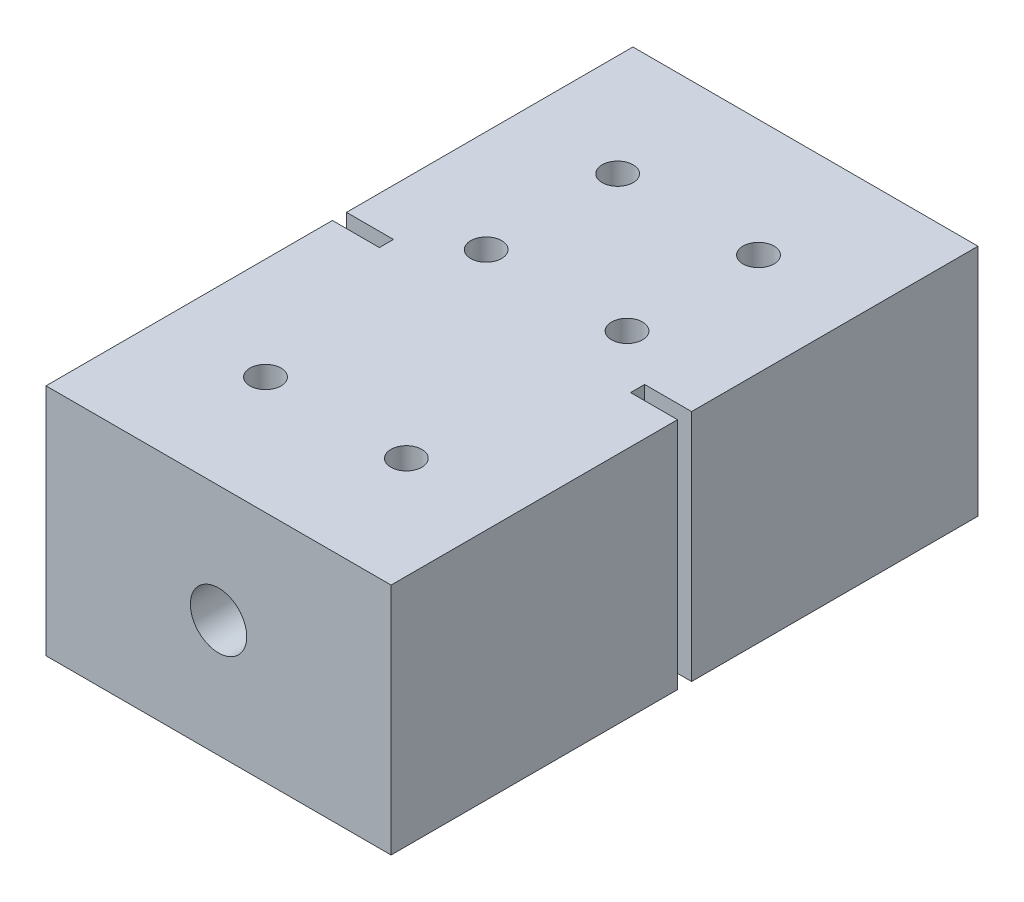
from build123d import *

# Parameters (mm, degrees)
SKETCH1_W                 = 73.5
SKETCH1_H                 = 49.8
SLIDER_BODY_DEPTH         = 125
SKETCH2_R                 = 10.95
LEAD_NUT_INSET_DEPTH      = 15
SKETCH3_R                 = 6
LEADSCREW_CLEARANCE_DEPTH = 142.358728064
SKETCH9_W                 = 10
SKETCH9_H                 = 3
DECOUPLING_SLIT_DEPTH     = 154.320872682
BOLT_CLEARANCE_HOLES_D    = 6.6


with BuildPart() as part:
    # Sketch1 → slider body (new body)
    with BuildSketch(Plane.XY):
        with Locations((36.75, 24.9)):
            Rectangle(SKETCH1_W, SKETCH1_H)
    extrude(amount=SLIDER_BODY_DEPTH)

    # Sketch2 → lead nut inset (cut)
    with BuildSketch(Plane(origin=(0, 0, 0), x_dir=(-1, 0, 0), z_dir=(0, 0, -1))):
        with Locations((-36.75, 24.9)):
            Circle(SKETCH2_R)
    extrude(amount=-LEAD_NUT_INSET_DEPTH, mode=Mode.SUBTRACT)

    # Sketch3 → leadscrew clearance (cut, through all)
    with BuildSketch(Plane(origin=(0, 0, 15), x_dir=(-1, 0, 0), z_dir=(0, 0, -1))):
        with Locations((-36.75, 24.9)):
            Circle(SKETCH3_R)
    extrude(amount=-LEADSCREW_CLEARANCE_DEPTH, mode=Mode.SUBTRACT)

    # Sketch9 → decoupling slit (cut, through all)
    with BuildSketch(Plane.XZ):
        with Locations((68.5, 62.5)):
            Rectangle(SKETCH9_W, SKETCH9_H)
    decoupling_slit = extrude(amount=-DECOUPLING_SLIT_DEPTH, mode=Mode.SUBTRACT)

    # bolt clearance holes (through all)
    with Locations(Plane(origin=(0, 49.8, 0), x_dir=(1, 0, 0), z_dir=(0, 1, 0))):
        with Locations((51.75, -100), (21.75, -25), (51.75, -25), (21.75, -100), (21.75, -53), (51.75, -53)):
            Hole(BOLT_CLEARANCE_HOLES_D / 2)

    # mirror slit: decoupling slit across plane
    add(decoupling_slit.mirror(Plane.ZY.offset(-36.75)), mode=Mode.SUBTRACT)


solid = part.part
